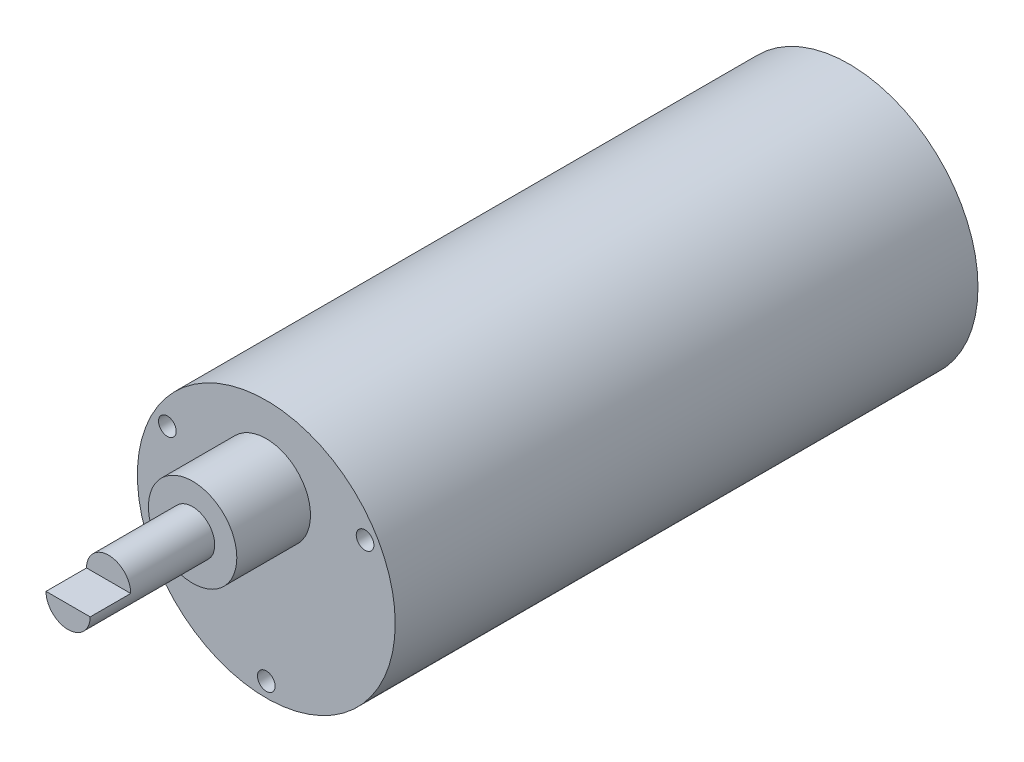
from build123d import *

# Parameters (mm, degrees)
ESQUISSE1_R             = 17.5
BOSS_EXTRU_1_DEPTH      = 79.1
ESQUISSE2_R             = 6
BOSS_EXTRU_2_DEPTH      = 10
ESQUISSE3_R             = 3
BOSS_EXTRU_3_DEPTH      = 16.9
ESQUISSE4_W             = 6
ESQUISSE4_H             = 3
ENL_V_MAT_EXTRU_1_DEPTH = 5.5
D_GAGEMENT_M24_D        = 2.4
D_GAGEMENT_M24_DEPTH    = 10
D_GAGEMENT_M24_TIP      = 0.721032743


with BuildPart() as part:
    # Esquisse1 → Boss.-Extru.1 (new body)
    with BuildSketch(Plane.XY):
        Circle(ESQUISSE1_R)
    extrude(amount=BOSS_EXTRU_1_DEPTH)

    # Esquisse2 → Boss.-Extru.2 (add)
    with BuildSketch(Plane.XY.offset(79.1)):
        with Locations((0, 7)):
            Circle(ESQUISSE2_R)
    extrude(amount=BOSS_EXTRU_2_DEPTH)

    # Esquisse3 → Boss.-Extru.3 (add)
    with BuildSketch(Plane.XY.offset(89.1)):
        with Locations((0, 7)):
            Circle(ESQUISSE3_R)
    extrude(amount=BOSS_EXTRU_3_DEPTH)

    # Esquisse4 → Enlèv. mat.-Extru.1 (cut)
    with BuildSketch(Plane.XY.offset(106)):
        with Locations((0, 8.5)):
            Rectangle(ESQUISSE4_W, ESQUISSE4_H)
    extrude(amount=-ENL_V_MAT_EXTRU_1_DEPTH, mode=Mode.SUBTRACT)

    # Dégagement M24
    with Locations(Plane(origin=(13.40635523, 7.779436963, 79.1), x_dir=(1, 0, 0), z_dir=(0, 0, 1))):
        with Locations((0, 0), (-13.40635523, -23.279436963), (-26.829748989, -0.029436963)):
            Hole(D_GAGEMENT_M24_D / 2, depth=D_GAGEMENT_M24_DEPTH)
            with Locations((0, 0, -(D_GAGEMENT_M24_DEPTH + D_GAGEMENT_M24_TIP / 2))):  # 118° drill point
                Cone(0, D_GAGEMENT_M24_D / 2, D_GAGEMENT_M24_TIP, mode=Mode.SUBTRACT)


solid = part.part
